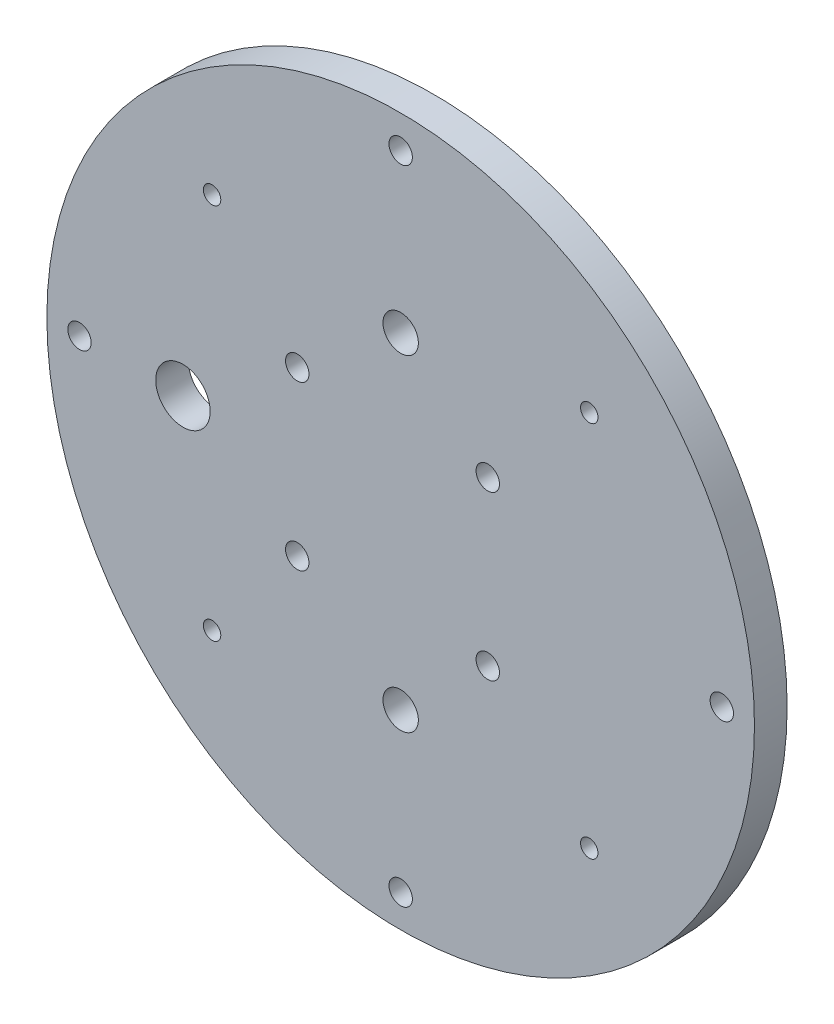
from build123d import *

# Parameters (mm, degrees)
SKETCH_1_R      = 65
SKETCH_1_R_2    = 1.6
SKETCH_1_R_3    = 2.15
SKETCH_1_R_4    = 3.25
SKETCH_1_R_5    = 5
EXTRUDE_1_DEPTH = 6


with BuildPart() as part:
    # 草圖1 → 填料-伸長1 (new body)
    with BuildSketch(Plane.XY):
        Circle(SKETCH_1_R)
        with Locations((34.648232278, 34.648232278)):
            Circle(SKETCH_1_R_2, mode=Mode.SUBTRACT)
        with Locations((-34.648232278, 34.648232278)):
            Circle(SKETCH_1_R_2, mode=Mode.SUBTRACT)
        with Locations((-34.648232278, -34.648232278)):
            Circle(SKETCH_1_R_2, mode=Mode.SUBTRACT)
        with Locations((34.648232278, -34.648232278)):
            Circle(SKETCH_1_R_2, mode=Mode.SUBTRACT)
        with Locations((59, 0)):
            Circle(SKETCH_1_R_3, mode=Mode.SUBTRACT)
        with Locations((0, 59)):
            Circle(SKETCH_1_R_3, mode=Mode.SUBTRACT)
        with Locations((-59, 0)):
            Circle(SKETCH_1_R_3, mode=Mode.SUBTRACT)
        with Locations((0, -59)):
            Circle(SKETCH_1_R_3, mode=Mode.SUBTRACT)
        with Locations((-19, 15)):
            Circle(SKETCH_1_R_3, mode=Mode.SUBTRACT)
        with Locations((-19, -15)):
            Circle(SKETCH_1_R_3, mode=Mode.SUBTRACT)
        with Locations((16, 15)):
            Circle(SKETCH_1_R_3, mode=Mode.SUBTRACT)
        with Locations((16, -15)):
            Circle(SKETCH_1_R_3, mode=Mode.SUBTRACT)
        with Locations((0, 30)):
            Circle(SKETCH_1_R_4, mode=Mode.SUBTRACT)
        with Locations((0, -30)):
            Circle(SKETCH_1_R_4, mode=Mode.SUBTRACT)
        with Locations((-40, 0)):
            Circle(SKETCH_1_R_5, mode=Mode.SUBTRACT)
    extrude(amount=EXTRUDE_1_DEPTH)


solid = part.part
